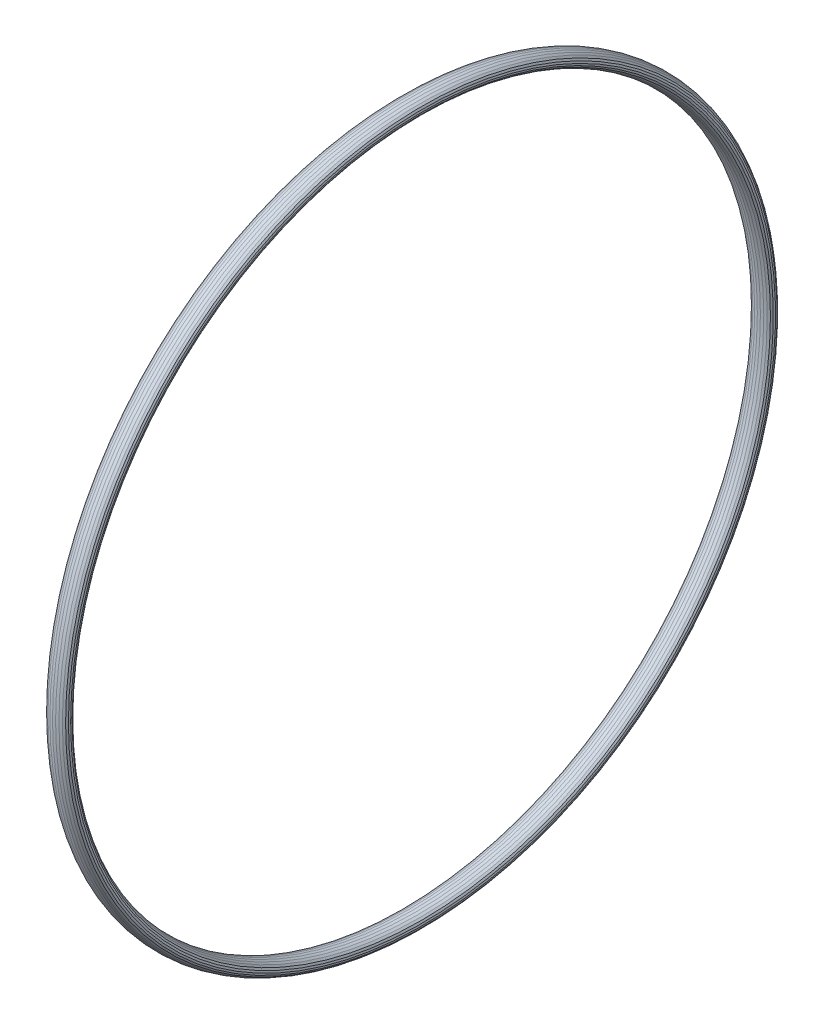
from build123d import *


with BuildPart() as part:
    # Tank_O_Ring Sketch → Tank_O_Ring (revolve)
    with BuildSketch(Plane.XY):
        Polygon((24.375, 71.42), (24.939023547, 71.371273932), (25.464609822, 71.228416327), (25.915940988, 71.001162697), (26.262259572, 70.705), (26.479964535, 70.360111234), (26.554219643, 69.99), (26.479964535, 69.619888766), (26.262259572, 69.275), (25.915940988, 68.978837303), (25.464609822, 68.751583673), (24.939023547, 68.608726068), (24.375, 68.56), (23.810976453, 68.608726068), (23.285390178, 68.751583673), (22.834059012, 68.978837303), (22.487740428, 69.275), (22.270035465, 69.619888766), (22.195780357, 69.99), (22.270035465, 70.360111234), (22.487740428, 70.705), (22.834059012, 71.001162697), (23.285390178, 71.228416327), (23.810976453, 71.371273932), align=None)
    revolve(axis=Axis((-1000, 0, 0), (1, 0, 0)))


solid = part.part
